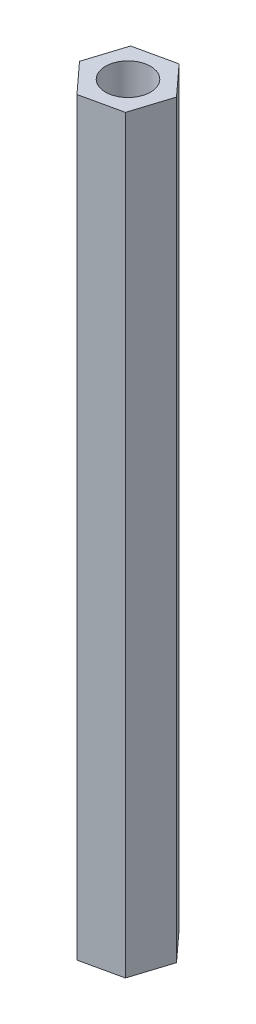
from build123d import *

# Parameters (mm, degrees)
SKETCH1_R           = 1.5
BOSS_EXTRUDE1_DEPTH = 50


with BuildPart() as part:
    # Sketch1 → Boss-Extrude1 (new body)
    with BuildSketch(Plane(origin=(0, 0, 0), x_dir=(1, 0, 0), z_dir=(0, 1, 0))):
        Polygon((-1.83059371, 2.003062655), (-2.65, -0.58380933), (-0.81940629, -2.586871985), (1.83059371, -2.003062655), (2.65, 0.58380933), (0.81940629, 2.586871985), align=None)
        with Locations(Location((0, 0, 0), (0, 0, 270))):
            Circle(SKETCH1_R, mode=Mode.SUBTRACT)
    extrude(amount=BOSS_EXTRUDE1_DEPTH)


solid = part.part
